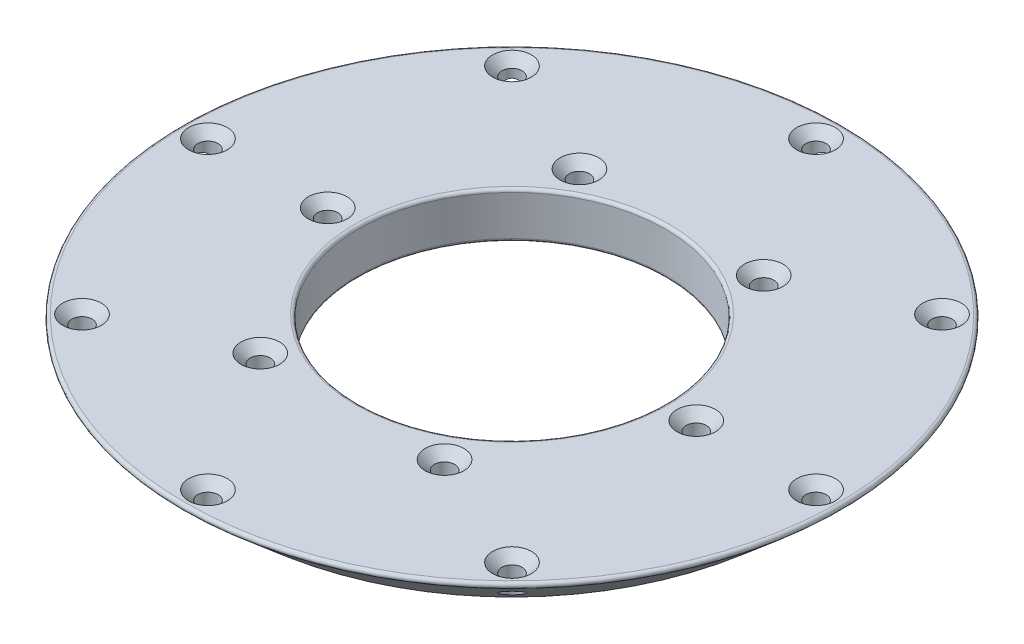
from build123d import *

# Parameters (mm, degrees)
CSK_FOR_M6_FLAT_HEAD_MACHINE_SCREW1_D           = 6.6
CSK_FOR_M6_FLAT_HEAD_MACHINE_SCREW1_DEPTH       = 15.001
CSK_FOR_M6_FLAT_HEAD_MACHINE_SCREW1_CSINK_D     = 12.6
CSK_FOR_M6_FLAT_HEAD_MACHINE_SCREW1_CSINK_ANGLE = 90
CSK_FOR_M6_FLAT_HEAD_MACHINE_SCREW2_D           = 6.6
CSK_FOR_M6_FLAT_HEAD_MACHINE_SCREW2_CSINK_D     = 12.6
CSK_FOR_M6_FLAT_HEAD_MACHINE_SCREW2_CSINK_ANGLE = 90
CIRPATTERN1_COUNT                               = 8
CIRPATTERN2_COUNT                               = 6
FINISHING_FILLET_R                              = 1


with BuildPart() as part:
    # Sketch1 → Revolve1 (revolve)
    with BuildSketch(Plane.XY, mode=Mode.PRIVATE) as revolve1_sk:
        Polygon((109, 15), (50, 15), (50, 0), (91.582188688, 0), align=None)
    revolve(revolve1_sk.sketch.rotate(Axis((0, 0, 0), (0, 1, 0)), 90), axis=Axis((0, 0, 0), (0, 1, 0)))

    # CSK for M6 Flat Head Machine Screw1
    with Locations(Plane(origin=(0, 15, 0), x_dir=(-1, 0, 0), z_dir=(0, 1, 0))):
        with Locations((-99, 0)):
            csk_for_m6_flat_head_machine_screw1 = CounterSinkHole(CSK_FOR_M6_FLAT_HEAD_MACHINE_SCREW1_D / 2, CSK_FOR_M6_FLAT_HEAD_MACHINE_SCREW1_CSINK_D / 2, depth=CSK_FOR_M6_FLAT_HEAD_MACHINE_SCREW1_DEPTH, counter_sink_angle=CSK_FOR_M6_FLAT_HEAD_MACHINE_SCREW1_CSINK_ANGLE)

    # CSK for M6 Flat Head Machine Screw2 (through all)
    with Locations(Plane(origin=(60, 15, 0), x_dir=(0, 0, 1), z_dir=(0, 1, 0))):
        with Locations((0, 0)):
            csk_for_m6_flat_head_machine_screw2 = CounterSinkHole(CSK_FOR_M6_FLAT_HEAD_MACHINE_SCREW2_D / 2, CSK_FOR_M6_FLAT_HEAD_MACHINE_SCREW2_CSINK_D / 2, counter_sink_angle=CSK_FOR_M6_FLAT_HEAD_MACHINE_SCREW2_CSINK_ANGLE)

    # CirPattern1: CSK for M6 Flat Head Machine Screw1 ×8 about axis
    cirpattern1_axis = Axis((0, 0, 0), (0, 1, 0))
    for i in range(1, CIRPATTERN1_COUNT):
        add(csk_for_m6_flat_head_machine_screw1.rotate(cirpattern1_axis, i * 360 / CIRPATTERN1_COUNT), mode=Mode.SUBTRACT)

    # CirPattern2: CSK for M6 Flat Head Machine Screw2 ×6 about axis
    cirpattern2_axis = Axis((0, 0, 0), (0, 1, 0))
    for i in range(1, CIRPATTERN2_COUNT):
        add(csk_for_m6_flat_head_machine_screw2.rotate(cirpattern2_axis, i * 360 / CIRPATTERN2_COUNT), mode=Mode.SUBTRACT)

    # Finishing Fillet
    finishing_fillet_edges = [part.edges().sort_by_distance(p)[0] for p in [
        (0, 15, 109),
        (0, 0, 50),
        (0, 15, 50),
    ]]
    fillet(finishing_fillet_edges, radius=FINISHING_FILLET_R)


solid = part.part
